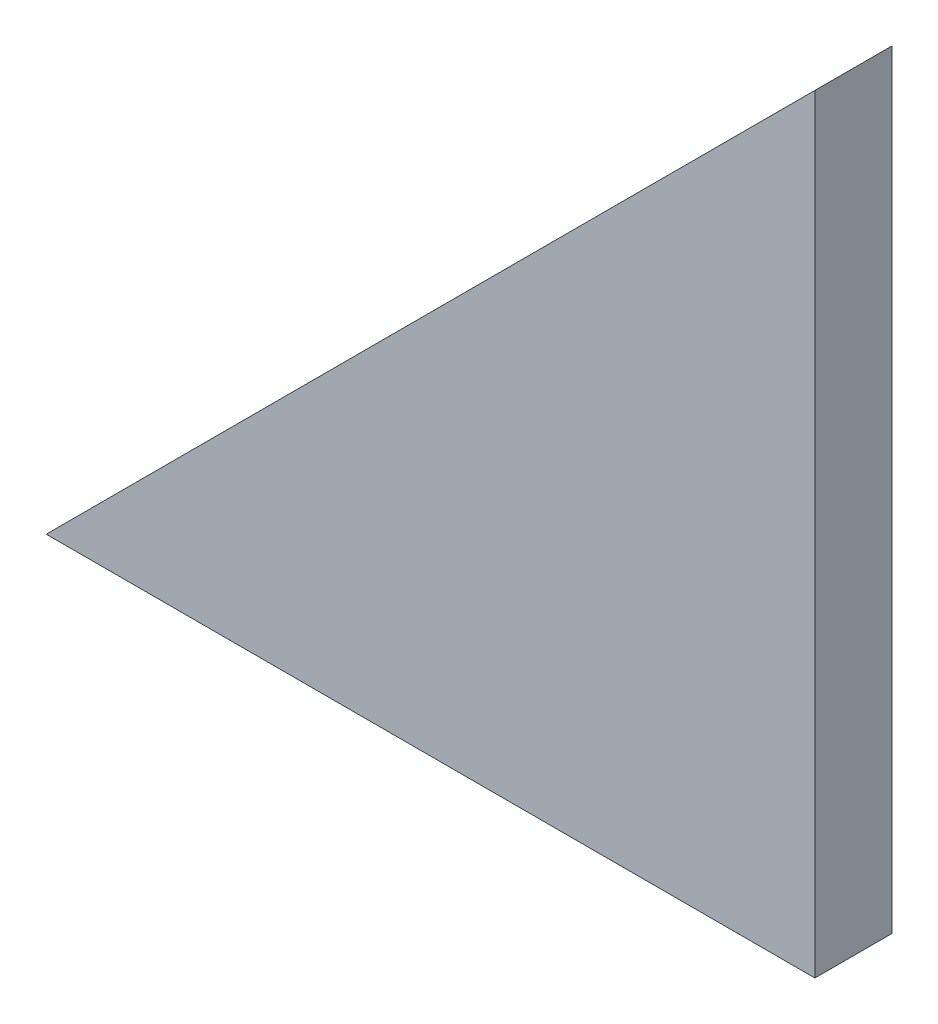
from build123d import *

# Parameters (mm, degrees)
EXTRUDE_1_DEPTH = 5


with BuildPart() as part:
    # 草图1 → 凸台-拉伸1 (new body)
    with BuildSketch(Plane.XY):
        Polygon((-76.293838046, -37.918494358), (-26.293838046, -37.918494358), (-26.293838046, 12.081505642), align=None)
    extrude(amount=EXTRUDE_1_DEPTH)


solid = part.part
